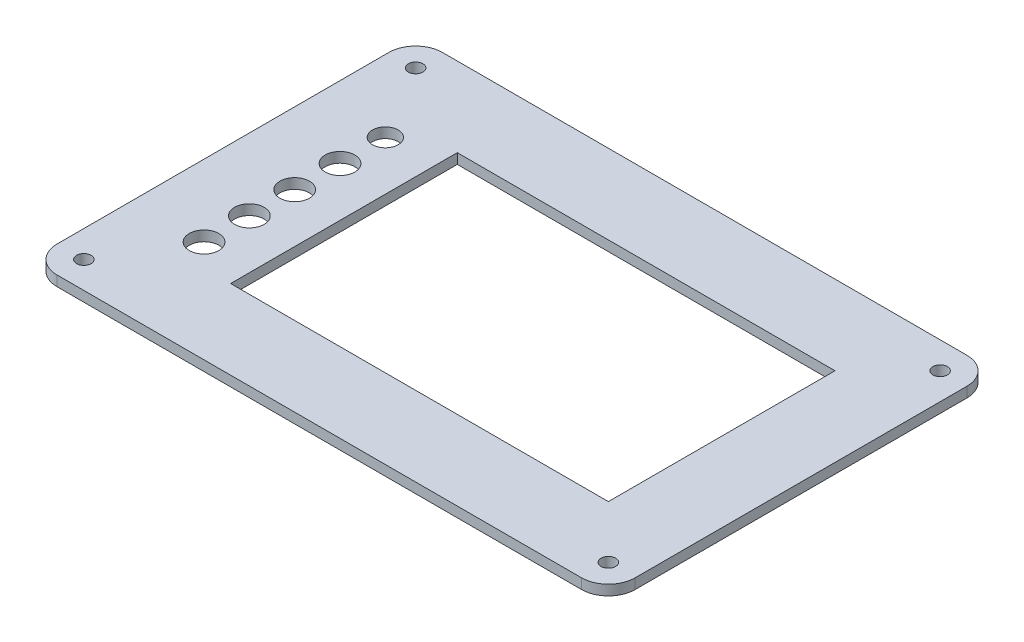
from build123d import *

# Parameters (mm, degrees)
SKETCH2_R                 = 1.1303
BOSS_EXTRUDE3_DEPTH       = 1.5875
SKETCH4_R                 = 1.9986
SKETCH4_R_2               = 2.3
CUT_EXTRUDE1_DEPTH        = 55.106562968
SKETCH3_W                 = 58.8
SKETCH3_H                 = 35.28
CUT_EXTRUDE2_DEPTH        = 55.106562968
TAP_DRILL_FOR_4_40_TAP1_D = 2.2606


with BuildPart() as part:
    # Sketch2 → Boss-Extrude3 (new body)
    with BuildSketch(Plane(origin=(0, 0, 0), x_dir=(1, 0, 0), z_dir=(0, 1, 0))):
        with BuildLine():
            Line((-45, 25.825), (-45, -25.825))
            ThreePointArc((-45, -25.825), (-43.777170811, -28.777170811), (-40.825, -30))
            Line((-40.825, -30), (40.825, -30))
            ThreePointArc((40.825, -30), (43.777170811, -28.777170811), (45, -25.825))
            Line((45, -25.825), (45, 25.825))
            ThreePointArc((45, 25.825), (43.777170811, 28.777170811), (40.825, 30))
            Line((40.825, 30), (-40.825, 30))
            ThreePointArc((-40.825, 30), (-43.777170811, 28.777170811), (-45, 25.825))
        make_face()
        with Locations(Location((40.825, 25.825, 0), (0, 0, 270))):
            Circle(SKETCH2_R, mode=Mode.SUBTRACT)
        with Locations(Location((40.825, -25.825, 0), (0, 0, 270))):
            Circle(SKETCH2_R, mode=Mode.SUBTRACT)
        with Locations(Location((-40.825, 25.825, 0), (0, 0, 270))):
            Circle(SKETCH2_R, mode=Mode.SUBTRACT)
        with Locations(Location((-40.825, -25.825, 0), (0, 0, 270))):
            Circle(SKETCH2_R, mode=Mode.SUBTRACT)
    extrude(amount=BOSS_EXTRUDE3_DEPTH)

    # Sketch4 → Cut-Extrude1 (cut, through all)
    with BuildSketch(Plane(origin=(0, 1.5875, 0), x_dir=(1, 0, 0), z_dir=(0, 1, 0))):
        with Locations(Location((-33.825, 14.109, 0), (0, 0, 270))):
            Circle(SKETCH4_R)
        with Locations(Location((-33.825, 7.053, 0), (0, 0, 270))):
            Circle(SKETCH4_R_2)
        with Locations(Location((-33.825, -0.003, 0), (0, 0, 270))):
            Circle(SKETCH4_R_2)
        with Locations(Location((-33.825, -7.059, 0), (0, 0, 270))):
            Circle(SKETCH4_R_2)
        with Locations(Location((-33.825, -14.115, 0), (0, 0, 270))):
            Circle(SKETCH4_R_2)
    extrude(amount=-CUT_EXTRUDE1_DEPTH, mode=Mode.SUBTRACT)

    # Sketch3 → Cut-Extrude2 (cut, through all)
    with BuildSketch(Plane(origin=(0, 1.5875, 0), x_dir=(1, 0, 0), z_dir=(0, 1, 0))):
        with Locations((3.24, 0)):
            Rectangle(SKETCH3_W, SKETCH3_H)
    extrude(amount=-CUT_EXTRUDE2_DEPTH, mode=Mode.SUBTRACT)

    # Tap Drill for #4-40 Tap1 (through all)
    with Locations(Plane(origin=(-40.825, 1.5875, 25.825), x_dir=(0, 0, 1), z_dir=(0, 1, 0))):
        with Locations((0, 0), (-51.65, 0), (-51.65, 81.65), (0, 81.65)):
            Hole(TAP_DRILL_FOR_4_40_TAP1_D / 2)


solid = part.part
